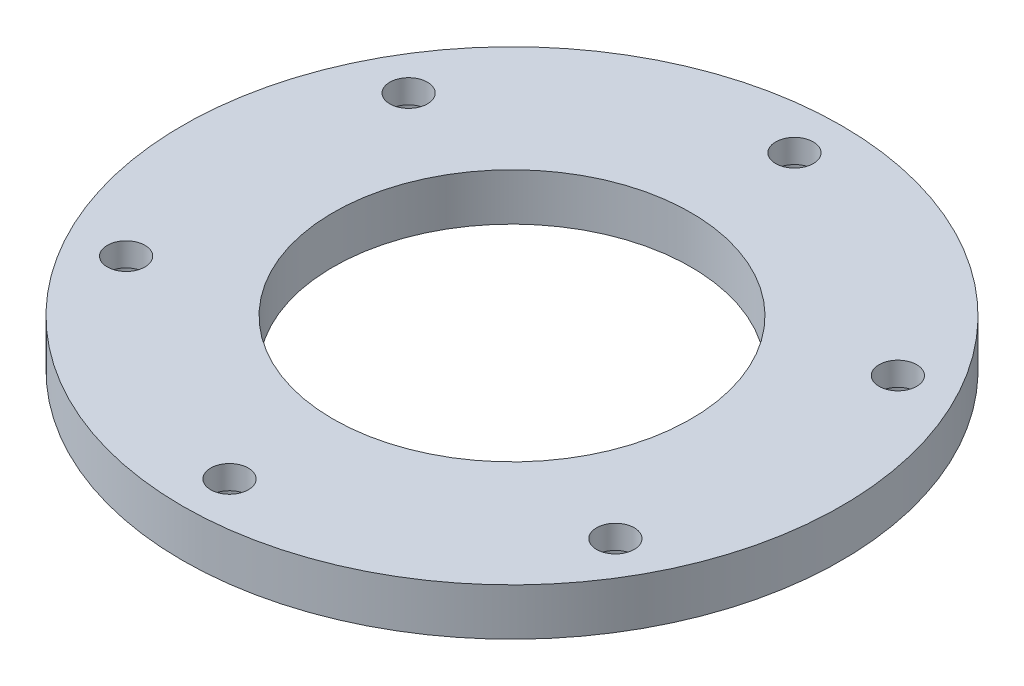
from build123d import *

# Parameters (mm, degrees)
SKETCH_1_R          = 35
SKETCH_1_R_2        = 19
SKETCH_1_R_3        = 2
EXTRUDE_1_DEPTH     = 5
SKETCH_2_R          = 3.75
CUT_EXTRUDE_1_DEPTH = 2.5


with BuildPart() as part:
    # 草图1 → 凸台-拉伸1 (new body)
    with BuildSketch(Plane(origin=(0, 0, 0), x_dir=(1, 0, 0), z_dir=(0, 1, 0))):
        with Locations(Location((0, 0, 0), (0, 0, 270))):
            Circle(SKETCH_1_R)
        with Locations(Location((0, 0, 0), (0, 0, 270))):
            Circle(SKETCH_1_R_2, mode=Mode.SUBTRACT)
        with Locations(Location((0, 30, 0), (0, 0, 270))):
            Circle(SKETCH_1_R_3, mode=Mode.SUBTRACT)
        with Locations(Location((25.980762114, 15, 0), (0, 0, 270))):
            Circle(SKETCH_1_R_3, mode=Mode.SUBTRACT)
        with Locations(Location((25.980762114, -15, 0), (0, 0, 270))):
            Circle(SKETCH_1_R_3, mode=Mode.SUBTRACT)
        with Locations(Location((0, -30, 0), (0, 0, 270))):
            Circle(SKETCH_1_R_3, mode=Mode.SUBTRACT)
        with Locations(Location((-25.980762114, -15, 0), (0, 0, 270))):
            Circle(SKETCH_1_R_3, mode=Mode.SUBTRACT)
        with Locations(Location((-25.980762114, 15, 0), (0, 0, 270))):
            Circle(SKETCH_1_R_3, mode=Mode.SUBTRACT)
    extrude(amount=EXTRUDE_1_DEPTH)

    # 草图2 → 切除-拉伸1 (cut)
    with BuildSketch(Plane.XZ):
        with Locations(Location((0, 30, 0), (0, 0, 270))):
            Circle(SKETCH_2_R)
        with Locations(Location((25.980762114, 15, 0), (0, 0, 270))):
            Circle(SKETCH_2_R)
        with Locations(Location((25.980762114, -15, 0), (0, 0, 270))):
            Circle(SKETCH_2_R)
        with Locations(Location((0, -30, 0), (0, 0, 270))):
            Circle(SKETCH_2_R)
        with Locations(Location((-25.980762114, -15, 0), (0, 0, 270))):
            Circle(SKETCH_2_R)
        with Locations(Location((-25.980762114, 15, 0), (0, 0, 270))):
            Circle(SKETCH_2_R)
    extrude(amount=-CUT_EXTRUDE_1_DEPTH, mode=Mode.SUBTRACT)


solid = part.part
